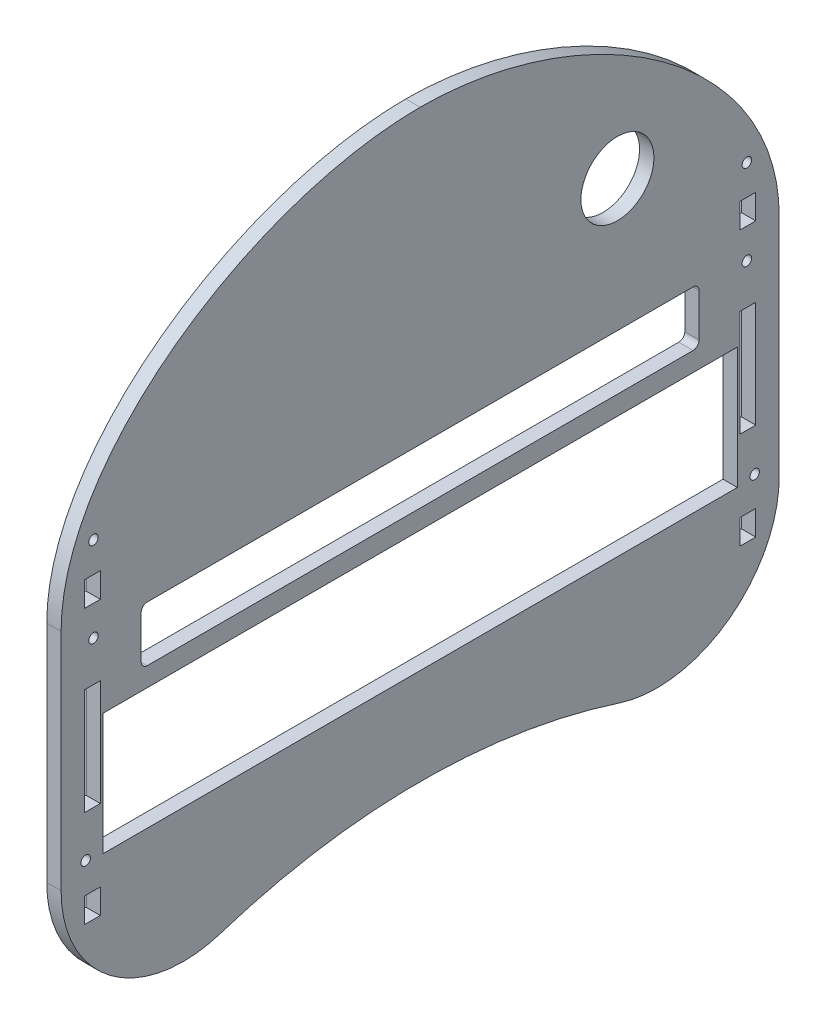
from build123d import *

# Parameters (mm, degrees)
SKETCH1_R      = 2.54
SKETCH1_W      = 6.55
SKETCH1_H      = 10.36
SKETCH1_R_2    = 1.984375
SKETCH1_H_2    = 44.45
SKETCH1_W_2    = 265
SKETCH1_H_3    = 50.8
SKETCH1_W_3    = 233.08
SKETCH1_H_4    = 23
SKETCH1_R_3    = 15.24
EXTRUDE1_DEPTH = 5.9944
FILLET3_R      = 50.8
FILLET4_R      = 50.8
FILLET5_R      = 50.8
FILLET6_R      = 50.8
FILLET12_R     = 2.54
FILLET13_R     = 2.54
FILLET14_R     = 2.54
FILLET15_R     = 2.54


with BuildPart() as part:
    # Sketch1 → Extrude1 (new body)
    # profile 1 of 2: a face of its own
    with BuildSketch(Plane(origin=(0, 0, 0), x_dir=(0, 0, -1), z_dir=(1, 0, 0))):
        with BuildLine():
            add(Edge.make_bspline(
                [(-150, 8.40657677), (-150, 69.992291428), (-70.289643695, 123), (0, 123)],
                knots=[0, 0, 0, 0, 1, 1, 1, 1], degree=3))
            Line((-150, 8.40657677), (-150, -102.588801706))
            ThreePointArc((-150, -102.588801706), (-131.77407574, -125.140142234), (-110.193405103, -144.505625175))
            ThreePointArc((-110.193405103, -144.505625175), (0, -120.975050934), (110.193405103, -144.505625175))
            ThreePointArc((110.193405103, -144.505625175), (131.77407574, -125.140142234), (150, -102.588801706))
            Line((150, -102.588801706), (150, 8.40657677))
            add(Edge.make_bspline(
                [(150, 8.40657677), (150, 69.992291428), (70.289643695, 123), (0, 123)],
                knots=[0, 0, 0, 0, 1, 1, 1, 1], degree=3))
        make_face()
        with Locations((-16.764, -115.55684695)):
            Circle(SKETCH1_R, mode=Mode.SUBTRACT)
        with Locations((-136.906, -97.408801706)):
            Rectangle(SKETCH1_W, SKETCH1_H, mode=Mode.SUBTRACT)
        with Locations(Location((-139.738064794, -79.628801706, 0), (0, 0, 180))):
            Circle(SKETCH1_R_2, mode=Mode.SUBTRACT)
        with Locations((-136.906, -39.850801706)):
            Rectangle(SKETCH1_W, SKETCH1_H_2, mode=Mode.SUBTRACT)
        with Locations((0, -55.4)):
            Rectangle(SKETCH1_W_2, SKETCH1_H_3, mode=Mode.SUBTRACT)
        with Locations((136.906, -97.408801706)):
            Rectangle(SKETCH1_W, SKETCH1_H, mode=Mode.SUBTRACT)
        with Locations(Location((139.738064794, -79.628801706, 0), (0, 0, 180))):
            Circle(SKETCH1_R_2, mode=Mode.SUBTRACT)
        with Locations((136.906, -39.850801706)):
            Rectangle(SKETCH1_W, SKETCH1_H_2, mode=Mode.SUBTRACT)
        with Locations(Location((-136.4742, -0.792101706, 0), (0, 0, 180))):
            Circle(SKETCH1_R_2, mode=Mode.SUBTRACT)
        with Locations((-136.906, 16.987898294)):
            Rectangle(SKETCH1_W, SKETCH1_H, mode=Mode.SUBTRACT)
        with Locations(Location((-136.4742, 34.767898294, 0), (0, 0, 180))):
            Circle(SKETCH1_R_2, mode=Mode.SUBTRACT)
        with Locations((0, -10.5)):
            Rectangle(SKETCH1_W_3, SKETCH1_H_4, mode=Mode.SUBTRACT)
        with Locations(Location((136.4742, -0.792101706, 0), (0, 0, 180))):
            Circle(SKETCH1_R_2, mode=Mode.SUBTRACT)
        with Locations((136.906, 16.987898294)):
            Rectangle(SKETCH1_W, SKETCH1_H, mode=Mode.SUBTRACT)
        with Locations(Location((136.4742, 34.767898294, 0), (0, 0, 180))):
            Circle(SKETCH1_R_2, mode=Mode.SUBTRACT)
        with Locations(Location((82.4, 56, 0), (0, 0, 180))):
            Circle(SKETCH1_R_3, mode=Mode.SUBTRACT)
    # profile 2 of 2: a face of its own
    with BuildSketch(Plane(origin=(0, 0, 0), x_dir=(0, 0, -1), z_dir=(1, 0, 0))):
        with Locations((-16.764, -115.55684695)):
            Circle(SKETCH1_R)
    extrude(amount=EXTRUDE1_DEPTH)

    # Fillet3
    fillet3_edges = [part.edges().sort_by_distance(p)[0] for p in [
        (2.9972, -102.588801706, 150),
    ]]
    fillet(fillet3_edges, radius=FILLET3_R)

    # Fillet4
    fillet4_edges = [part.edges().sort_by_distance(p)[0] for p in [
        (2.9972, -144.505625175, 110.193405103),
    ]]
    fillet(fillet4_edges, radius=FILLET4_R)

    # Fillet5
    fillet5_edges = [part.edges().sort_by_distance(p)[0] for p in [
        (2.9972, -144.505625175, -110.193405103),
    ]]
    fillet(fillet5_edges, radius=FILLET5_R)

    # Fillet6
    fillet6_edges = [part.edges().sort_by_distance(p)[0] for p in [
        (2.9972, -102.588801706, -150),
    ]]
    fillet(fillet6_edges, radius=FILLET6_R)

    # Fillet12
    fillet12_edges = [part.edges().sort_by_distance(p)[0] for p in [
        (2.9972, -22, 116.54),
    ]]
    fillet(fillet12_edges, radius=FILLET12_R)

    # Fillet13
    fillet13_edges = [part.edges().sort_by_distance(p)[0] for p in [
        (2.9972, 1, 116.54),
    ]]
    fillet(fillet13_edges, radius=FILLET13_R)

    # Fillet14
    fillet14_edges = [part.edges().sort_by_distance(p)[0] for p in [
        (2.9972, 1, -116.54),
    ]]
    fillet(fillet14_edges, radius=FILLET14_R)

    # Fillet15
    fillet15_edges = [part.edges().sort_by_distance(p)[0] for p in [
        (2.9972, -22, -116.54),
    ]]
    fillet(fillet15_edges, radius=FILLET15_R)


solid = part.part
